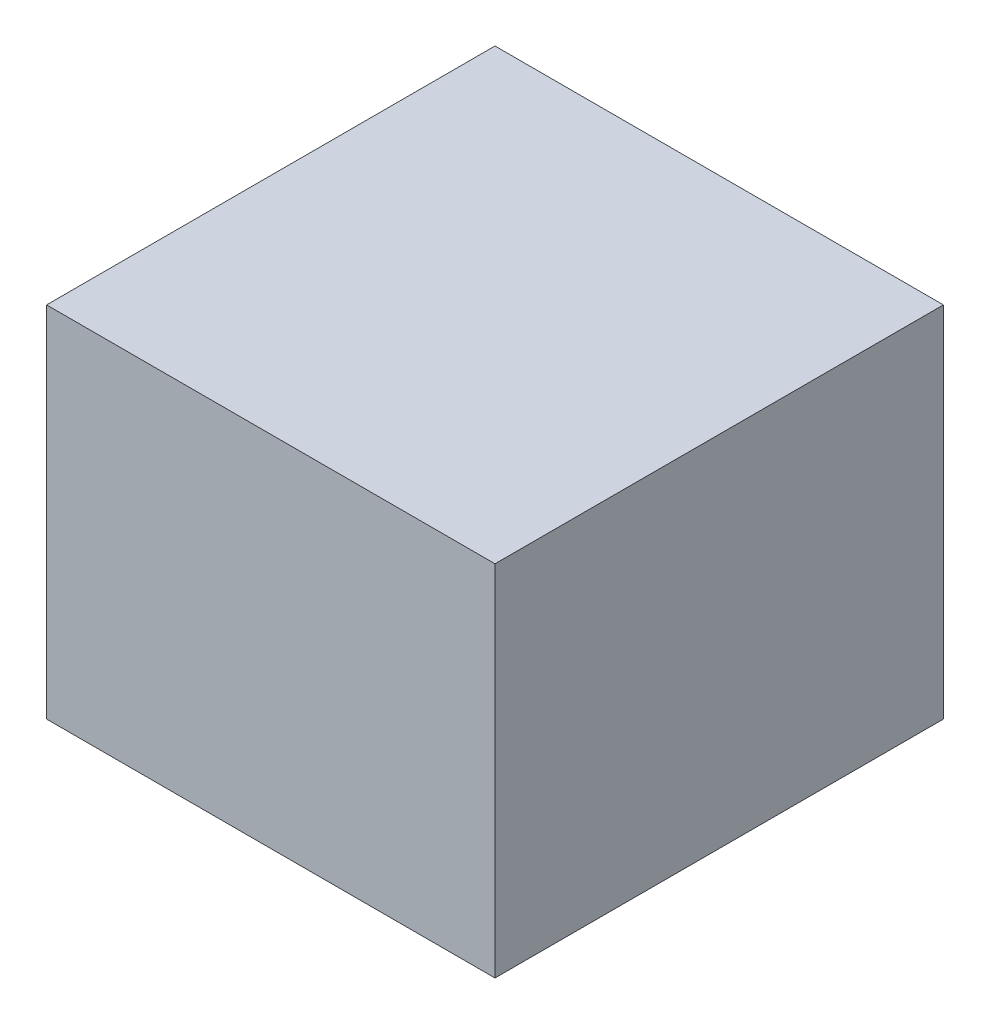
from build123d import *

# Parameters (mm, degrees)
SK_P01_BOX_W  = 50
SK_P01_BOX_H  = 50
P01_BOX_DEPTH = 40


with BuildPart() as part:
    # SK_P01_box → P01_box (new body)
    with BuildSketch(Plane(origin=(0, 0, 0), x_dir=(1, 0, 0), z_dir=(0, 1, 0))):
        Rectangle(SK_P01_BOX_W, SK_P01_BOX_H)
    extrude(amount=P01_BOX_DEPTH)


solid = part.part
